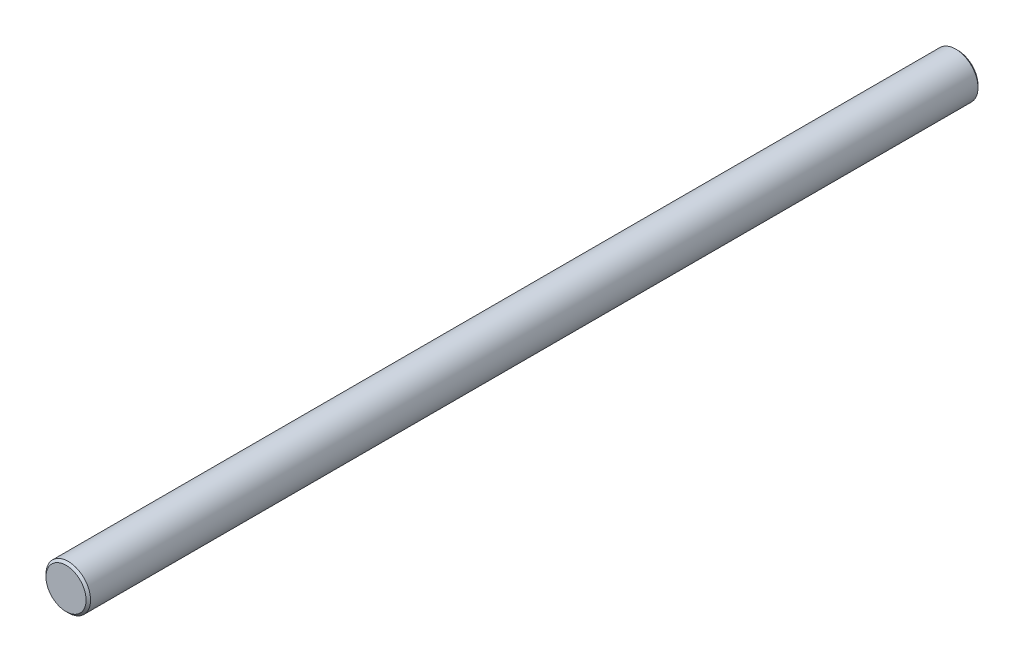
from build123d import *

# Parameters (mm, degrees)
SKETCH1_R           = 10
BOSS_EXTRUDE1_DEPTH = 400
CHAMFER1_SIZE       = 1
SKETCH2_R           = 3
CUT_EXTRUDE1_DEPTH  = 10
LPATTERN1_COUNT     = 3
LPATTERN1_PITCH     = 150


with BuildPart() as part:
    # Sketch1 → Boss-Extrude1 (new body)
    with BuildSketch(Plane.XY):
        Circle(SKETCH1_R)
    extrude(amount=BOSS_EXTRUDE1_DEPTH)

    # Chamfer1
    chamfer1_edges = [part.edges().sort_by_distance(p)[0] for p in [
        (-10, 0, 0),
        (-10, 0, 400),
    ]]
    chamfer(chamfer1_edges, length=CHAMFER1_SIZE)

    # Sketch2 → Cut-Extrude1 (cut)
    with BuildSketch(Plane(origin=(0, 0, 0), x_dir=(1, 0, 0), z_dir=(0, 1, 0))):
        with Locations(Location((0, -15, 0), (0, 0, 270))):
            Circle(SKETCH2_R)
    cut_extrude1 = extrude(amount=-CUT_EXTRUDE1_DEPTH, mode=Mode.SUBTRACT)

    # LPattern1: Cut-Extrude1 ×3
    with Locations(*[(0, 0, i * LPATTERN1_PITCH) for i in range(1, LPATTERN1_COUNT)]):
        add(cut_extrude1, mode=Mode.SUBTRACT)


solid = part.part
